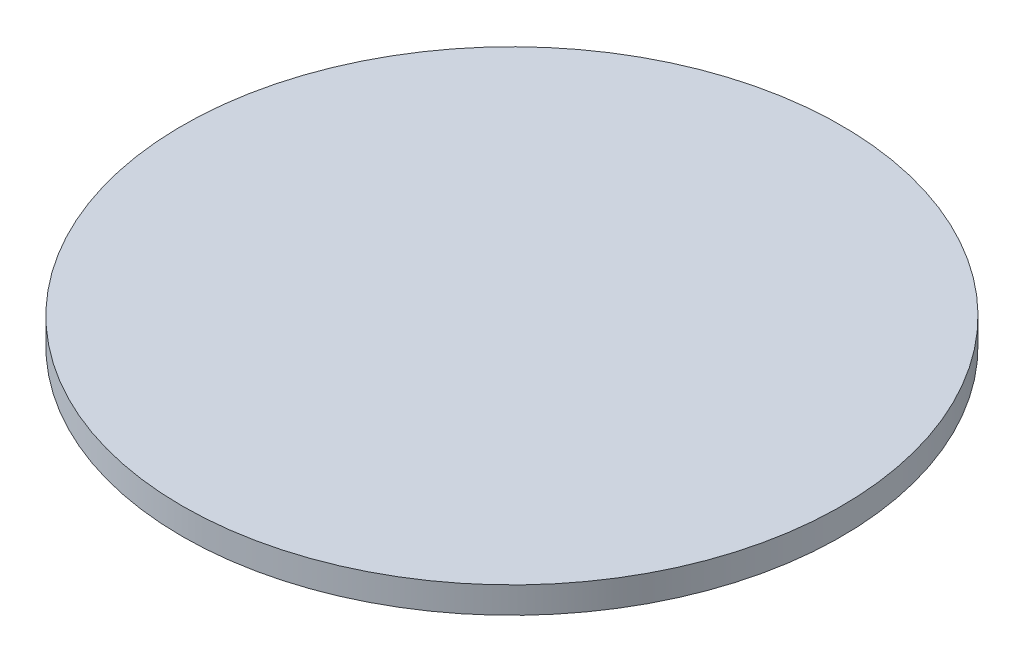
from build123d import *

# Parameters (mm, degrees)
SKETCH1_R           = 25
BOSS_EXTRUDE1_DEPTH = 70
BOSS_EXTRUDE2_DEPTH = 5
SKETCH3_R           = 125
BOSS_EXTRUDE3_DEPTH = 10


with BuildPart() as part:
    # Sketch1 → Boss-Extrude1 (new body)
    with BuildSketch(Plane(origin=(0, 0, 0), x_dir=(1, 0, 0), z_dir=(0, 1, 0))):
        with Locations(Location((0, 0, 0), (0, 0, 270))):
            Circle(SKETCH1_R)
    extrude(amount=BOSS_EXTRUDE1_DEPTH)

    # Sketch2 → Boss-Extrude2 (add)
    with BuildSketch(Plane(origin=(0, 40, 0), x_dir=(1, 0, 0), z_dir=(0, 1, 0))):
        with BuildLine():
            ThreePointArc((-49.768073149, -4.810290534), (49.989018115, 1.047887371), (-49.925935592, 2.720469675))
            ThreePointArc((-49.925935592, 2.720469675), (-99.550770715, -2.086818253), (-49.768073149, -4.810290534))
        make_face()
    extrude(amount=BOSS_EXTRUDE2_DEPTH)

    # Sketch3 → Boss-Extrude3 (add)
    with BuildSketch(Plane(origin=(0, 70, 0), x_dir=(1, 0, 0), z_dir=(0, 1, 0))):
        with Locations(Location((0, 0, 0), (0, 0, 270))):
            Circle(SKETCH3_R)
    extrude(amount=BOSS_EXTRUDE3_DEPTH)


solid = part.part
